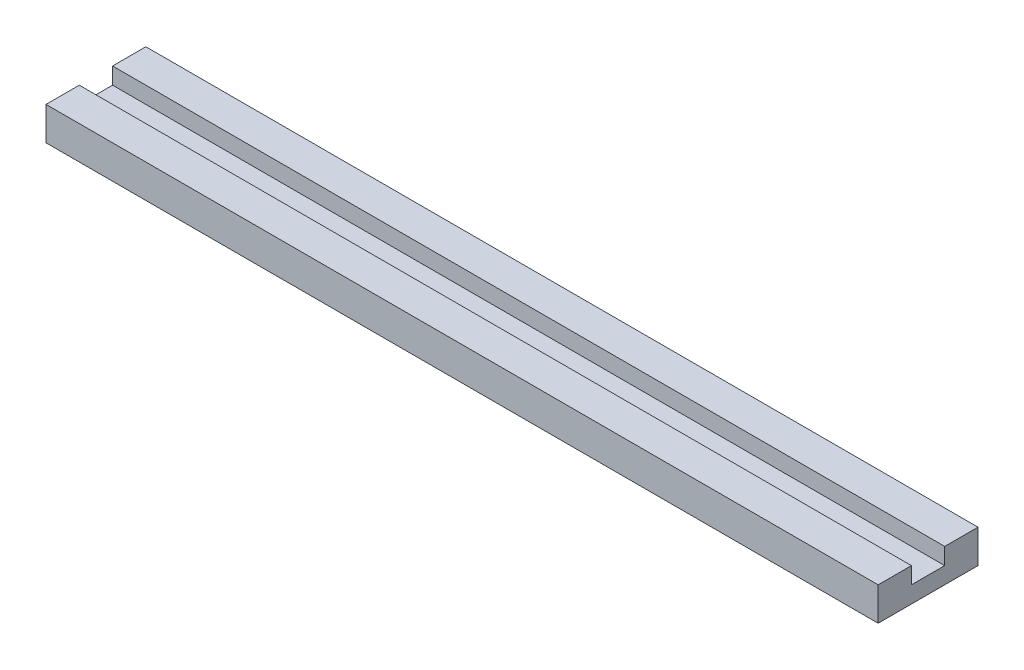
from build123d import *

# Parameters (mm, degrees)
EXTRUDE_1_DEPTH = 50


with BuildPart() as part:
    # 草图1 → 凸台-拉伸1 (new, symmetric)
    with BuildSketch(Plane(origin=(0, 0, 0), x_dir=(0, 0, -1), z_dir=(1, 0, 0))):
        Polygon((-2, 2), (-6, 2), (-6, -2), (6, -2), (6, 2), (2, 2), (2, 0), (-2, 0), align=None)
    extrude(amount=EXTRUDE_1_DEPTH, both=True)


solid = part.part
